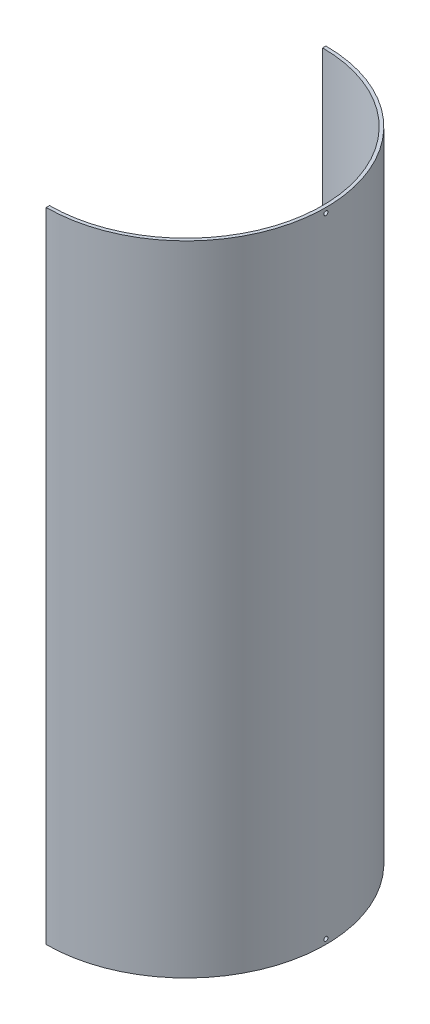
from build123d import *

# Parameters (mm, degrees)
BOSS_EXTRUDE1_DEPTH = 388
SKETCH2_R           = 1.25
CUT_EXTRUDE1_DEPTH  = 202


with BuildPart() as part:
    # Sketch1 → Boss-Extrude1 (new body)
    with BuildSketch(Plane(origin=(0, 0, 0), x_dir=(1, 0, 0), z_dir=(0, 1, 0))):
        with BuildLine():
            Line((0, 85), (0, 83))
            ThreePointArc((0, 83), (83, 0), (0, -83))
            Line((0, -83), (0, -85))
            ThreePointArc((0, -85), (85, 0), (0, 85))
        make_face()
    extrude(amount=BOSS_EXTRUDE1_DEPTH)

    # Sketch2 → Cut-Extrude1 (cut)
    with BuildSketch(Plane(origin=(0, 0, 0), x_dir=(0, 0, -1), z_dir=(1, 0, 0))):
        with Locations(Location((0, 385, 0), (0, 0, 180))):
            Circle(SKETCH2_R)
        with Locations(Location((0, 3, 0), (0, 0, 180))):
            Circle(SKETCH2_R)
    extrude(amount=CUT_EXTRUDE1_DEPTH, mode=Mode.SUBTRACT)


solid = part.part
